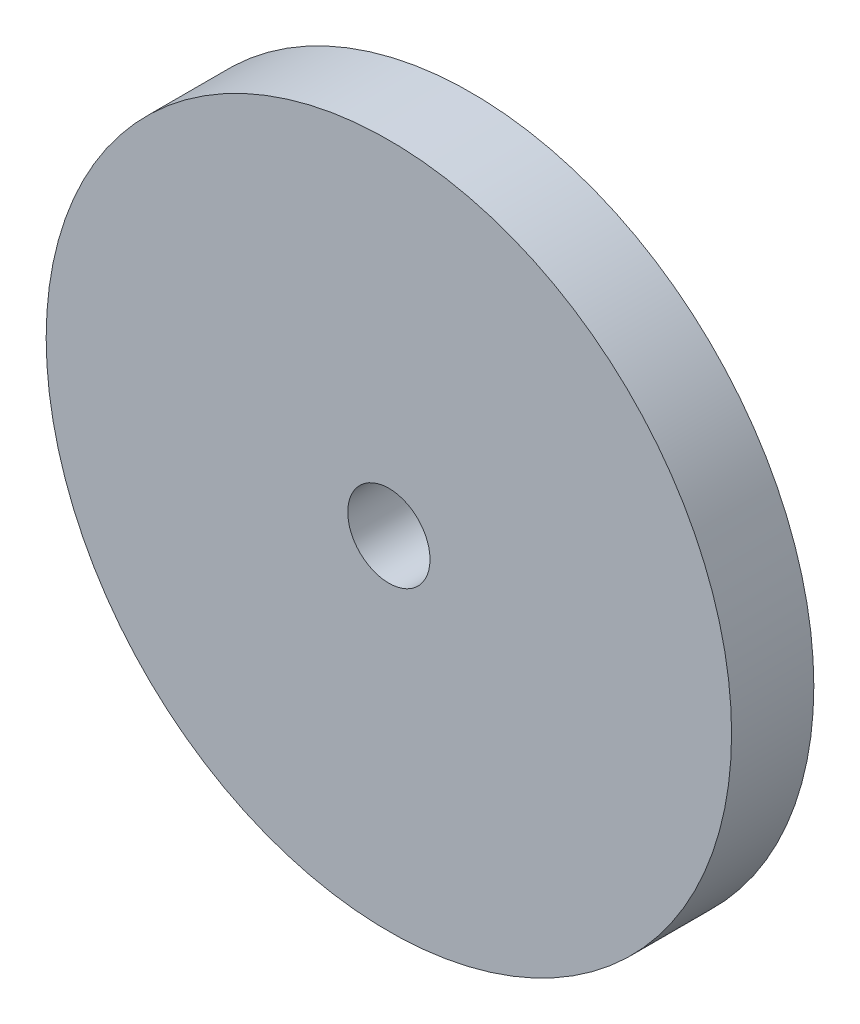
from build123d import *

# Parameters (mm, degrees)
SKETCH1_R           = 12.5
SKETCH1_R_2         = 1.5
BOSS_EXTRUDE1_DEPTH = 3


with BuildPart() as part:
    # Sketch1 → Boss-Extrude1 (new body)
    with BuildSketch(Plane.XY):
        Circle(SKETCH1_R)
        Circle(SKETCH1_R_2, mode=Mode.SUBTRACT)
    extrude(amount=BOSS_EXTRUDE1_DEPTH)


solid = part.part
